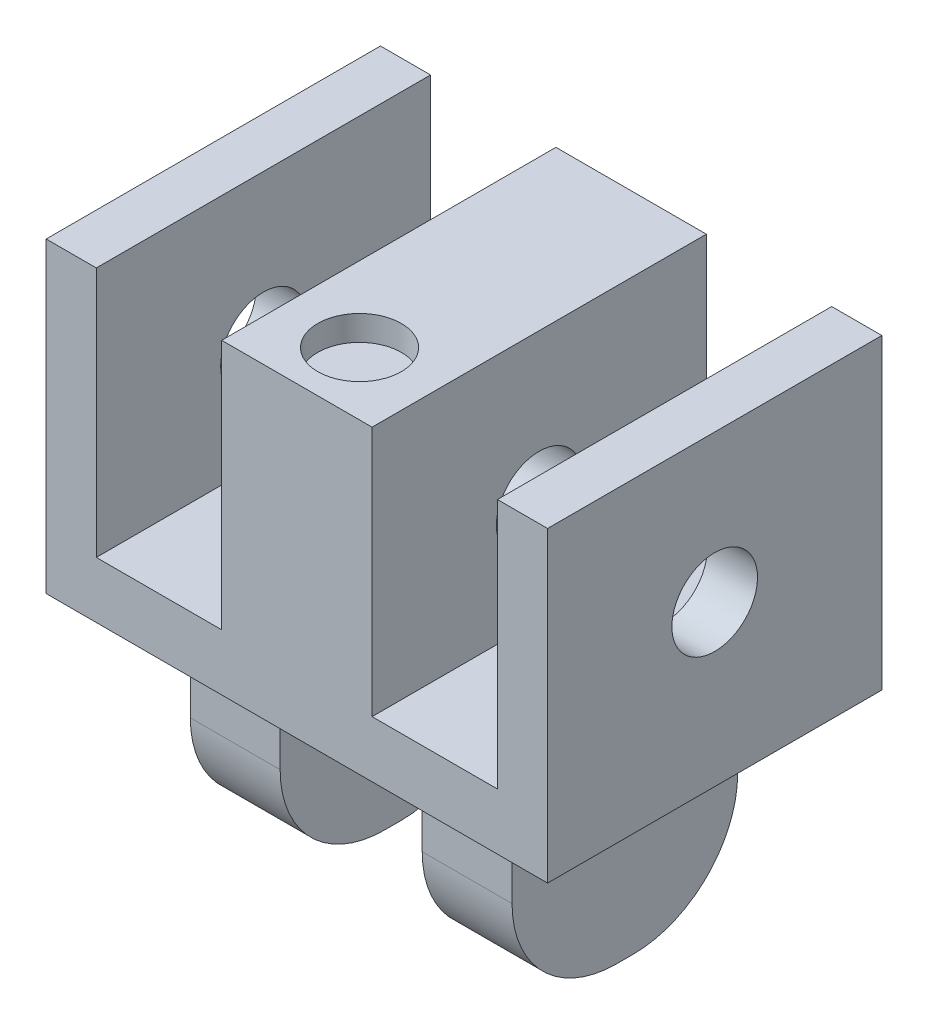
from build123d import *

# Parameters (mm, degrees)
BOSS_EXTRUDE1_DEPTH     = 54
CUT_EXTRUDE1_DEPTH      = 145.623649518
CUT_EXTRUDE1_DEPTH_BACK = 145.623649518
SKETCH2_R               = 10.25
CUT_EXTRUDE2_DEPTH      = 145.623649518
CUT_EXTRUDE2_DEPTH_BACK = 145.623649518
SKETCH3_R               = 10.25
CUT_EXTRUDE3_DEPTH      = 101.578327685
CUT_EXTRUDE3_DEPTH_BACK = 101.578327685
SKETCH4_W               = 21.5
SKETCH4_H               = 46.5
FILLET1_R               = 25
SKETCH5_W               = 120
SKETCH5_H               = 13
BOSS_EXTRUDE2_DEPTH     = 73.5
SKETCH6_W               = 30
SKETCH6_H               = 80
CUT_EXTRUDE4_DEPTH      = 60
SKETCH7_R               = 10
CUT_EXTRUDE5_DEPTH      = 6


with BuildPart() as part:
    # Sketch1 → Boss-Extrude1 (new body)
    with BuildSketch(Plane.XY):
        Polygon((60, 60), (-60, 60), (-60, -60), (-17, -60), (-17, -13.5), (17, -13.5), (17, -60), (60, -60), align=None)
    extrude(amount=BOSS_EXTRUDE1_DEPTH)

    # Sketch2 → Cut-Extrude1 (cut, two sides: drawn at the far end of the back side and taken through both)
    with BuildSketch(Plane(origin=(60, 0, 0), x_dir=(0, 0, -1), z_dir=(1, 0, 0)).offset(-CUT_EXTRUDE1_DEPTH_BACK)):
        with Locations(Location((-27, -24.75, 0), (0, 0, 90))):
            Circle(SKETCH2_R)
    extrude(amount=CUT_EXTRUDE1_DEPTH + CUT_EXTRUDE1_DEPTH_BACK, mode=Mode.SUBTRACT)

    # Sketch3 → Cut-Extrude2 (cut, two sides: drawn at the far end of the back side and taken through both)
    with BuildSketch(Plane(origin=(60, 0, 0), x_dir=(0, 0, -1), z_dir=(1, 0, 0)).offset(-CUT_EXTRUDE2_DEPTH_BACK)):
        with Locations(Location((-27, 24.75, 0), (0, 0, 90))):
            Circle(SKETCH3_R)
    extrude(amount=CUT_EXTRUDE2_DEPTH + CUT_EXTRUDE2_DEPTH_BACK, mode=Mode.SUBTRACT)

    # Sketch4 → Cut-Extrude3 (cut, two sides: drawn at the far end of the back side and taken through both)
    with BuildSketch(Plane.XY.offset(54).offset(-CUT_EXTRUDE3_DEPTH_BACK)):
        with Locations((-49.25, -36.75)):
            Rectangle(SKETCH4_W, SKETCH4_H)
        with Locations((49.25, -36.75)):
            Rectangle(SKETCH4_W, SKETCH4_H)
    extrude(amount=CUT_EXTRUDE3_DEPTH + CUT_EXTRUDE3_DEPTH_BACK, mode=Mode.SUBTRACT)

    # Fillet1
    fillet1_edges = [part.edges().sort_by_distance(p)[0] for p in [
        (27.75, -60, 0),
        (27.75, -60, 54),
        (-27.75, -60, 0),
        (-27.75, -60, 54),
    ]]
    fillet(fillet1_edges, radius=FILLET1_R)

    # Sketch5 → Boss-Extrude2 (add)
    with BuildSketch(Plane(origin=(0, 60, 0), x_dir=(1, 0, 0), z_dir=(0, 1, 0))):
        with Locations((0, 6.5)):
            Rectangle(SKETCH5_W, SKETCH5_H)
        with Locations((0, -60.5)):
            Rectangle(SKETCH5_W, SKETCH5_H)
    extrude(amount=-BOSS_EXTRUDE2_DEPTH)

    # Sketch6 → Cut-Extrude4 (cut)
    with BuildSketch(Plane(origin=(0, 60, 0), x_dir=(1, 0, 0), z_dir=(0, 1, 0))):
        with Locations((-33, -27)):
            Rectangle(SKETCH6_W, SKETCH6_H)
        with Locations((33, -27)):
            Rectangle(SKETCH6_W, SKETCH6_H)
    extrude(amount=-CUT_EXTRUDE4_DEPTH, mode=Mode.SUBTRACT)

    # Sketch7 → Cut-Extrude5 (cut)
    with BuildSketch(Plane(origin=(0, 60, 0), x_dir=(1, 0, 0), z_dir=(0, 1, 0))):
        with Locations(Location((0, -52, 0), (0, 0, 270))):
            Circle(SKETCH7_R)
    extrude(amount=-CUT_EXTRUDE5_DEPTH, mode=Mode.SUBTRACT)


solid = part.part
